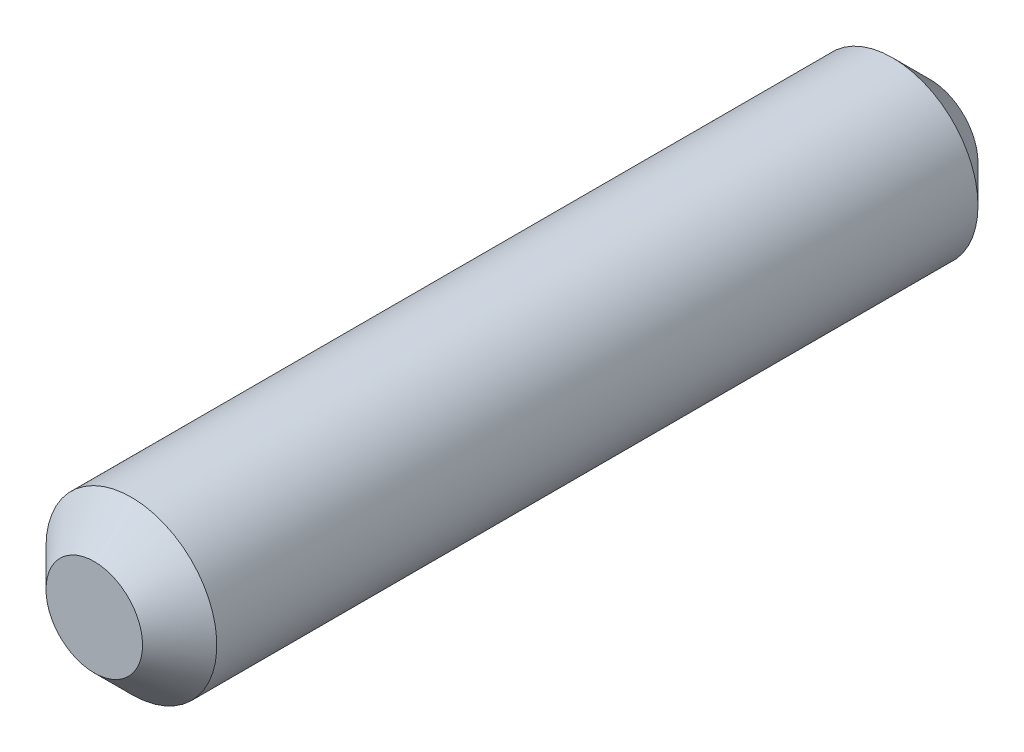
from build123d import *

# Parameters (mm, degrees)
SKETCH1_R           = 2.3
BOSS_EXTRUDE1_DEPTH = 11.25
CHAMFER1_SIZE       = 1


with BuildPart() as part:
    # Sketch1 → Boss-Extrude1 (new, symmetric)
    with BuildSketch(Plane.XY):
        with Locations(Location((0, 0, 0), (0, 0, 180))):
            Circle(SKETCH1_R)
    extrude(amount=BOSS_EXTRUDE1_DEPTH, both=True)

    # Chamfer1
    chamfer1_edges = [part.edges().sort_by_distance(p)[0] for p in [
        (2.3, 0, -11.25),
        (2.3, 0, 11.25),
    ]]
    chamfer(chamfer1_edges, length=CHAMFER1_SIZE)


solid = part.part
